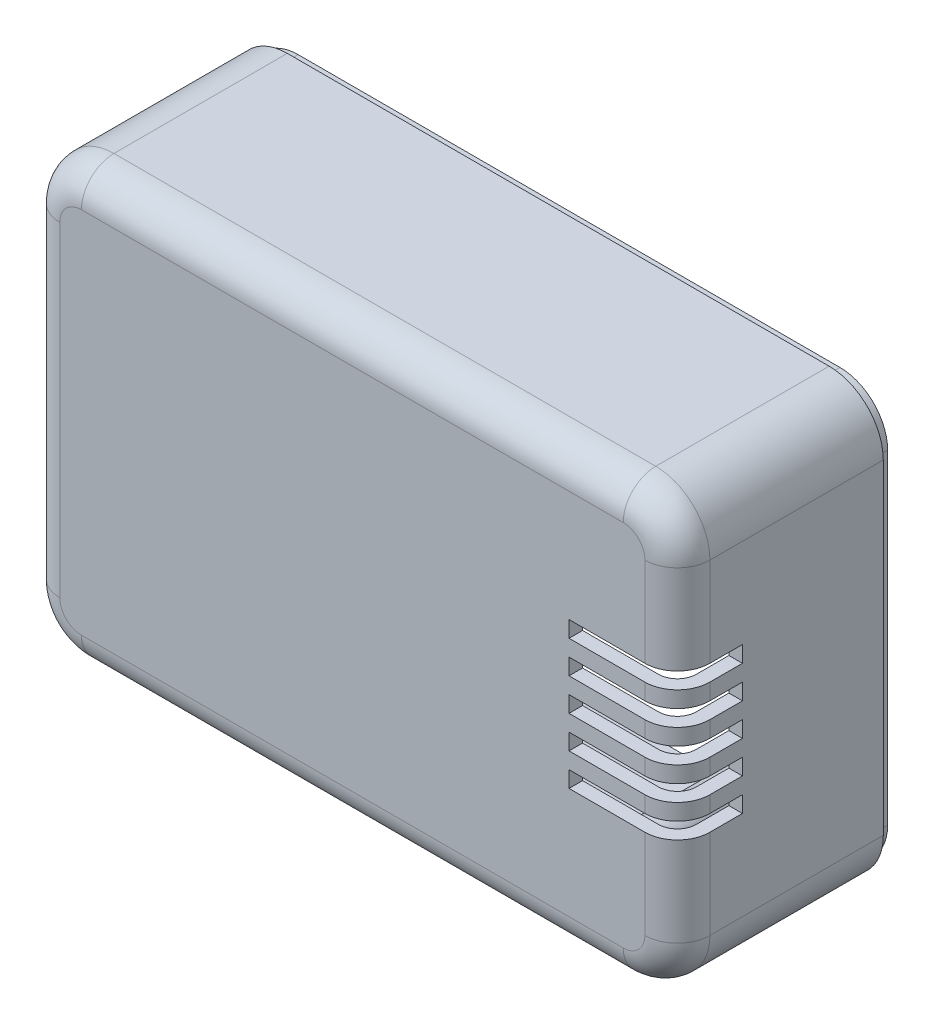
from build123d import *

# Parameters (mm, degrees)
EXTRUDE_1_DEPTH        = 40
FILLET_1_R             = 6
SHELL_2_T              = -2.5
CUT_EXTRUDE_1_DEPTH    = 2
SKETCH_3_W             = 21
SKETCH_3_H             = 13
CUT_EXTRUDE_2_DEPTH    = 1.5
PATTERN_LINEAR_1_COUNT = 5
PATTERN_LINEAR_1_PITCH = 6
SKETCH_4_R             = 4
EXTRUDE_2_DEPTH        = 32.5
SKETCH_5_R             = 1.25
CUT_EXTRUDE_3_DEPTH    = 12


with BuildPart() as part:
    # 草图1 → 凸台-拉伸1 (new body)
    with BuildSketch(Plane.XY):
        with BuildLine():
            Line((-50, -40), (50, -40))
            ThreePointArc((50, -40), (57.071067812, -37.071067812), (60, -30))
            Line((60, -30), (60, 30))
            ThreePointArc((60, 30), (57.071067812, 37.071067812), (50, 40))
            Line((50, 40), (-50, 40))
            ThreePointArc((-50, 40), (-57.071067812, 37.071067812), (-60, 30))
            Line((-60, 30), (-60, -30))
            ThreePointArc((-60, -30), (-57.071067812, -37.071067812), (-50, -40))
        make_face()
    extrude(amount=EXTRUDE_1_DEPTH)

    # 圆角1
    fillet_1_edges = [part.edges().sort_by_distance(p)[0] for p in [
        (57.071067812, -37.071067812, 40),
        (60, 0, 40),
        (57.071067812, 37.071067812, 40),
        (0, 40, 40),
        (-57.071067812, 37.071067812, 40),
        (-60, 0, 40),
        (-57.071067812, -37.071067812, 40),
        (0, -40, 40),
    ]]
    fillet(fillet_1_edges, radius=FILLET_1_R)

    # 抽壳2
    shell_2_openings = [part.faces().sort_by_distance(p)[0] for p in [
        (0, 0, 0),
    ]]
    offset(amount=SHELL_2_T, openings=shell_2_openings, kind=Kind.INTERSECTION)

    # 草图2 → 切除-拉伸1 (cut)
    with BuildSketch(Plane.XY):
        with BuildLine():
            Line((-50, -40), (50, -40))
            ThreePointArc((50, -40), (57.071067812, -37.071067812), (60, -30))
            Line((60, -30), (60, 30))
            ThreePointArc((60, 30), (57.071067812, 37.071067812), (50, 40))
            Line((50, 40), (-50, 40))
            ThreePointArc((-50, 40), (-57.071067812, 37.071067812), (-60, 30))
            Line((-60, 30), (-60, -30))
            ThreePointArc((-60, -30), (-57.071067812, -37.071067812), (-50, -40))
        make_face()
        with BuildLine():
            Line((-50, -38.8), (50, -38.8))
            ThreePointArc((50, -38.8), (56.222539674, -36.222539674), (58.8, -30))
            Line((58.8, -30), (58.8, 30))
            ThreePointArc((58.8, 30), (56.222539674, 36.222539674), (50, 38.8))
            Line((50, 38.8), (-50, 38.8))
            ThreePointArc((-50, 38.8), (-56.222539674, 36.222539674), (-58.8, 30))
            Line((-58.8, 30), (-58.8, -30))
            ThreePointArc((-58.8, -30), (-56.222539674, -36.222539674), (-50, -38.8))
        make_face(mode=Mode.SUBTRACT)
    extrude(amount=CUT_EXTRUDE_1_DEPTH, mode=Mode.SUBTRACT)

    # 草图3 → 切除-拉伸2 (cut, symmetric)
    with BuildSketch(Plane(origin=(0, -12, 0), x_dir=(1, 0, 0), z_dir=(0, 1, 0))):
        with Locations((50.5, -34.5)):
            Rectangle(SKETCH_3_W, SKETCH_3_H)
    cut_extrude_2 = extrude(amount=CUT_EXTRUDE_2_DEPTH, both=True, mode=Mode.SUBTRACT)

    # 阵列(线性)1: 切除-拉伸2 ×5
    with Locations(*[(0, i * PATTERN_LINEAR_1_PITCH, 0) for i in range(1, PATTERN_LINEAR_1_COUNT)]):
        add(cut_extrude_2, mode=Mode.SUBTRACT)

    # 草图4 → 凸台-拉伸2 (add)
    with BuildSketch(Plane.XY.offset(5)):
        with Locations((-45, -25)):
            Circle(SKETCH_4_R)
        with Locations((-45, 25)):
            Circle(SKETCH_4_R)
        with Locations((45, -25)):
            Circle(SKETCH_4_R)
        with Locations((45, 25)):
            Circle(SKETCH_4_R)
    extrude(amount=EXTRUDE_2_DEPTH)

    # 草图5 → 切除-拉伸3 (cut)
    with BuildSketch(Plane.XY.offset(5)):
        with Locations((-45, -25)):
            Circle(SKETCH_5_R)
        with Locations((-45, 25)):
            Circle(SKETCH_5_R)
        with Locations((45, -25)):
            Circle(SKETCH_5_R)
        with Locations((45, 25)):
            Circle(SKETCH_5_R)
    extrude(amount=CUT_EXTRUDE_3_DEPTH, mode=Mode.SUBTRACT)


solid = part.part
